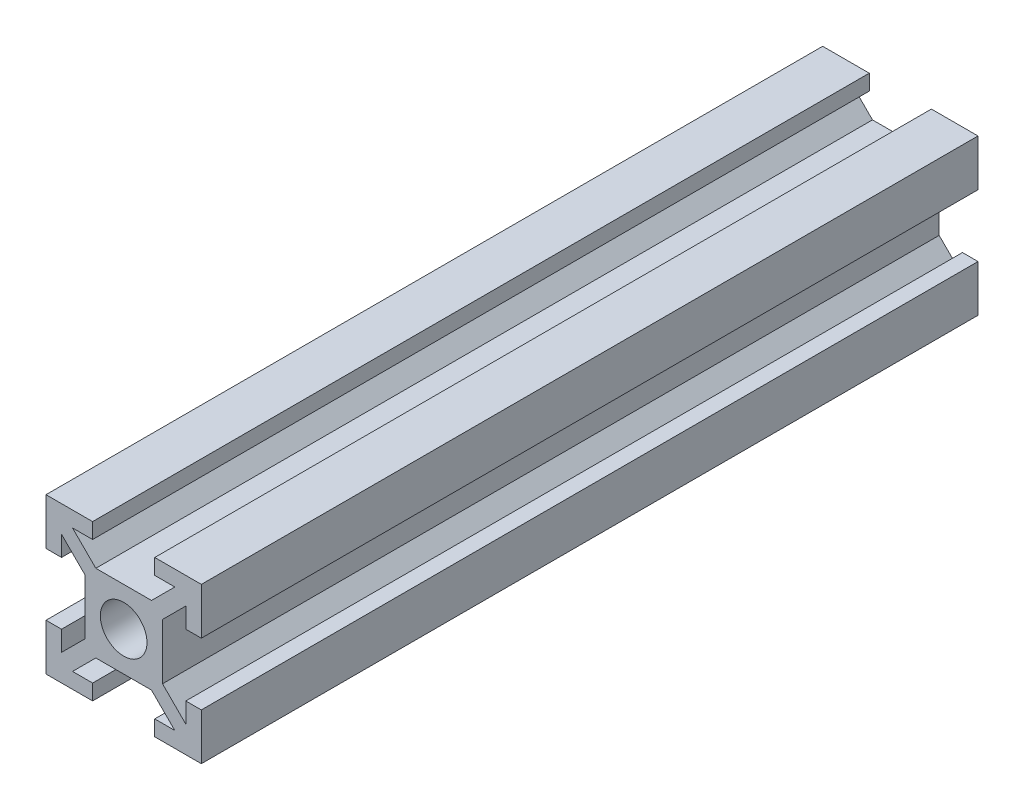
from build123d import *

# Parameters (mm, degrees)
SKETCH_1_R      = 3
EXTRUDE_1_DEPTH = 100


with BuildPart() as part:
    # 草图1 → 凸台-拉伸1 (new body)
    with BuildSketch(Plane.XY):
        Polygon((-10, 4), (-8, 4), (-8, 6.585786438), (-5, 3.585786438), (-5, -3.585786438), (-8, -6.585786438), (-8, -4), (-10, -4), (-10, -10), (-4, -10), (-4, -8), (-6.585786438, -8), (-3.585786438, -5), (3.585786438, -5), (6.585786438, -8), (4, -8), (4, -10), (10, -10), (10, -4), (8, -4), (8, -6.585786438), (5, -3.585786438), (5, 3.585786438), (8, 6.585786438), (8, 4), (10, 4), (10, 10), (4, 10), (4, 8), (6.585786438, 8), (3.585786438, 5), (-3.585786438, 5), (-6.585786438, 8), (-4, 8), (-4, 10), (-10, 10), align=None)
        Circle(SKETCH_1_R, mode=Mode.SUBTRACT)
    extrude(amount=EXTRUDE_1_DEPTH)


solid = part.part
